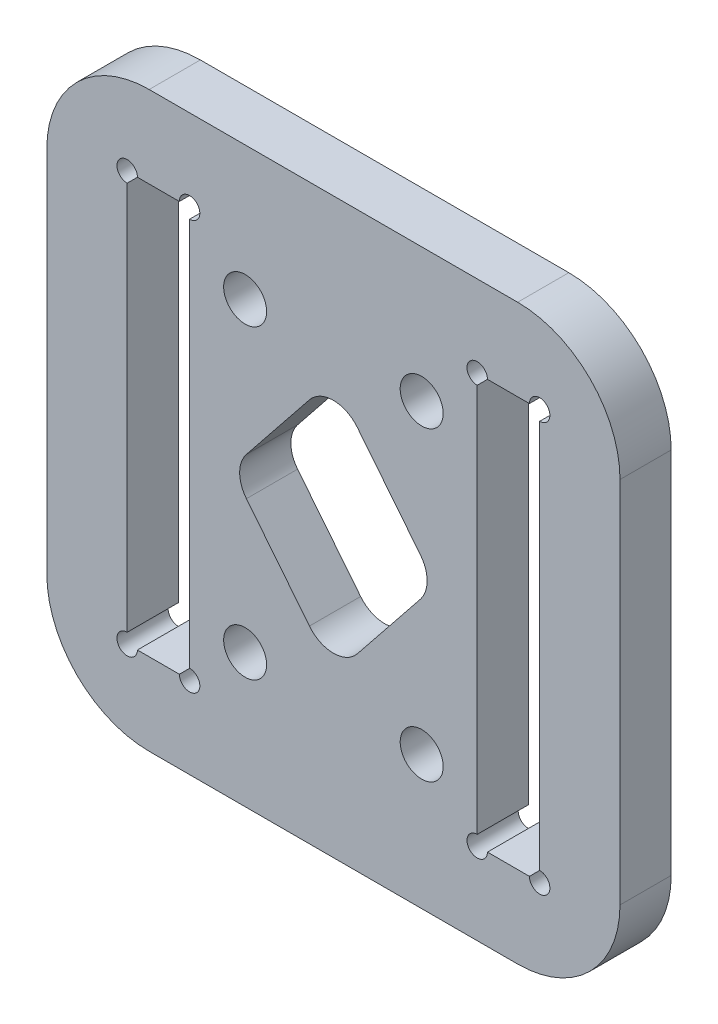
from build123d import *

# Parameters (mm, degrees)
SKETCH_1_W          = 56
SKETCH_1_H          = 56
SKETCH_1_R          = 2.1
EXTRUDE_1_DEPTH     = 5
FILLET_1_R          = 10
CUT_EXTRUDE_1_DEPTH = 16
CUT_EXTRUDE_2_DEPTH = 16


with BuildPart() as part:
    # 草图1 → 凸台-拉伸1 (new body)
    with BuildSketch(Plane.XY):
        with Locations((28, -28)):
            Rectangle(SKETCH_1_W, SKETCH_1_H)
        with Locations((36.625, -13.061061785)):
            Circle(SKETCH_1_R, mode=Mode.SUBTRACT)
        with Locations((19.375, -13.061061785)):
            Circle(SKETCH_1_R, mode=Mode.SUBTRACT)
        with Locations((36.625, -42.938938215)):
            Circle(SKETCH_1_R, mode=Mode.SUBTRACT)
        with Locations((19.375, -42.938938215)):
            Circle(SKETCH_1_R, mode=Mode.SUBTRACT)
    extrude(amount=EXTRUDE_1_DEPTH)

    # 圆角1
    fillet_1_edges = [part.edges().sort_by_distance(p)[0] for p in [
        (56, -56, 2.5),
        (0, -56, 2.5),
        (0, 0, 2.5),
        (56, 0, 2.5),
    ]]
    fillet(fillet_1_edges, radius=FILLET_1_R)

    # 草图2 → 切除-拉伸1 (cut)
    with BuildSketch(Plane.XY.offset(5)):
        with BuildLine():
            Line((47.15, -8), (43.05, -8))
            ThreePointArc((43.05, -8), (42.757106781, -8.707106781), (42.05, -9))
            Line((42.05, -9), (42.05, -47))
            ThreePointArc((42.05, -47), (42.757106781, -47.292893219), (43.05, -48))
            Line((43.05, -48), (47.15, -48))
            ThreePointArc((47.15, -48), (47.442893219, -47.292893219), (48.15, -47))
            Line((48.15, -47), (48.15, -9))
            ThreePointArc((48.15, -9), (47.442893219, -8.707106781), (47.15, -8))
        make_face()
        with BuildLine():
            ThreePointArc((43.05, -8), (42.757106781, -7.292893219), (42.05, -7))
            Line((42.05, -7), (42.05, -8))
            Line((42.05, -8), (43.05, -8))
        make_face()
        with BuildLine():
            Line((43.05, -8), (42.05, -8))
            Line((42.05, -8), (42.05, -9))
            ThreePointArc((42.05, -9), (42.757106781, -8.707106781), (43.05, -8))
        make_face()
        with BuildLine():
            Line((42.05, -8), (42.05, -7))
            ThreePointArc((42.05, -7), (41.05, -8), (42.05, -9))
            Line((42.05, -9), (42.05, -8))
        make_face()
        with BuildLine():
            ThreePointArc((49.15, -8), (48.15, -7), (47.15, -8))
            Line((47.15, -8), (48.15, -8))
            Line((48.15, -8), (48.15, -9))
            ThreePointArc((48.15, -9), (48.857106781, -8.707106781), (49.15, -8))
        make_face()
        with BuildLine():
            Line((48.15, -8), (47.15, -8))
            ThreePointArc((47.15, -8), (47.442893219, -8.707106781), (48.15, -9))
            Line((48.15, -9), (48.15, -8))
        make_face()
        with BuildLine():
            ThreePointArc((49.15, -48), (48.857106781, -47.292893219), (48.15, -47))
            Line((48.15, -47), (48.15, -48))
            Line((48.15, -48), (47.15, -48))
            ThreePointArc((47.15, -48), (48.15, -49), (49.15, -48))
        make_face()
        with BuildLine():
            Line((48.15, -48), (48.15, -47))
            ThreePointArc((48.15, -47), (47.442893219, -47.292893219), (47.15, -48))
            Line((47.15, -48), (48.15, -48))
        make_face()
        with BuildLine():
            ThreePointArc((43.05, -48), (42.757106781, -47.292893219), (42.05, -47))
            Line((42.05, -47), (42.05, -48))
            Line((42.05, -48), (43.05, -48))
        make_face()
        with BuildLine():
            Line((43.05, -48), (42.05, -48))
            Line((42.05, -48), (42.05, -49))
            ThreePointArc((42.05, -49), (42.757106781, -48.707106781), (43.05, -48))
        make_face()
        with BuildLine():
            Line((42.05, -48), (42.05, -47))
            ThreePointArc((42.05, -47), (41.05, -48), (42.05, -49))
            Line((42.05, -49), (42.05, -48))
        make_face()
        with BuildLine():
            Line((13.95, -48), (13.95, -47))
            ThreePointArc((13.95, -47), (13.242893219, -47.292893219), (12.95, -48))
            Line((12.95, -48), (13.95, -48))
        make_face()
        with BuildLine():
            ThreePointArc((12.95, -48), (13.242893219, -48.707106781), (13.95, -49))
            Line((13.95, -49), (13.95, -48))
            Line((13.95, -48), (12.95, -48))
        make_face()
        with BuildLine():
            ThreePointArc((14.95, -48), (14.657106781, -47.292893219), (13.95, -47))
            Line((13.95, -47), (13.95, -48))
            Line((13.95, -48), (13.95, -49))
            ThreePointArc((13.95, -49), (14.657106781, -48.707106781), (14.95, -48))
        make_face()
        with BuildLine():
            ThreePointArc((13.95, -9), (13.242893219, -8.707106781), (12.95, -8))
            Line((12.95, -8), (8.85, -8))
            ThreePointArc((8.85, -8), (8.557106781, -8.707106781), (7.85, -9))
            Line((7.85, -9), (7.85, -47))
            ThreePointArc((7.85, -47), (8.557106781, -47.292893219), (8.85, -48))
            Line((8.85, -48), (12.95, -48))
            ThreePointArc((12.95, -48), (13.242893219, -47.292893219), (13.95, -47))
            Line((13.95, -47), (13.95, -9))
        make_face()
        with BuildLine():
            ThreePointArc((8.85, -48), (8.557106781, -47.292893219), (7.85, -47))
            Line((7.85, -47), (7.85, -48))
            Line((7.85, -48), (8.85, -48))
        make_face()
        with BuildLine():
            Line((7.85, -48), (7.85, -47))
            ThreePointArc((7.85, -47), (7.142893219, -48.707106781), (8.85, -48))
            Line((8.85, -48), (7.85, -48))
        make_face()
        with BuildLine():
            ThreePointArc((7.85, -9), (8.557106781, -8.707106781), (8.85, -8))
            Line((8.85, -8), (7.85, -8))
            Line((7.85, -8), (7.85, -9))
        make_face()
        with BuildLine():
            Line((7.85, -8), (8.85, -8))
            ThreePointArc((8.85, -8), (7.142893219, -7.292893219), (7.85, -9))
            Line((7.85, -9), (7.85, -8))
        make_face()
        with BuildLine():
            ThreePointArc((14.95, -8), (14.657106781, -7.292893219), (13.95, -7))
            Line((13.95, -7), (13.95, -8))
            Line((13.95, -8), (13.95, -9))
            ThreePointArc((13.95, -9), (14.657106781, -8.707106781), (14.95, -8))
        make_face()
        with BuildLine():
            Line((13.95, -8), (13.95, -7))
            ThreePointArc((13.95, -7), (13.242893219, -7.292893219), (12.95, -8))
            Line((12.95, -8), (13.95, -8))
        make_face()
        with BuildLine():
            Line((13.95, -9), (13.95, -8))
            Line((13.95, -8), (12.95, -8))
            ThreePointArc((12.95, -8), (13.242893219, -8.707106781), (13.95, -9))
        make_face()
    extrude(amount=-CUT_EXTRUDE_1_DEPTH, mode=Mode.SUBTRACT)

    # 草图3 → 切除-拉伸2 (cut)
    with BuildSketch(Plane.XY.offset(5)):
        with BuildLine():
            Line((25.657393572, -18.428258035), (19.499268114, -26.125914857))
            ThreePointArc((19.499268114, -26.125914857), (18.841874542, -28), (19.499268114, -29.874085143))
            Line((19.499268114, -29.874085143), (25.657393572, -37.571741965))
            ThreePointArc((25.657393572, -37.571741965), (28, -38.697656822), (30.342606428, -37.571741965))
            Line((30.342606428, -37.571741965), (36.500731886, -29.874085143))
            ThreePointArc((36.500731886, -29.874085143), (37.158125458, -28), (36.500731886, -26.125914857))
            Line((36.500731886, -26.125914857), (30.342606428, -18.428258035))
            ThreePointArc((30.342606428, -18.428258035), (28, -17.302343178), (25.657393572, -18.428258035))
        make_face()
    extrude(amount=-CUT_EXTRUDE_2_DEPTH, mode=Mode.SUBTRACT)


solid = part.part
